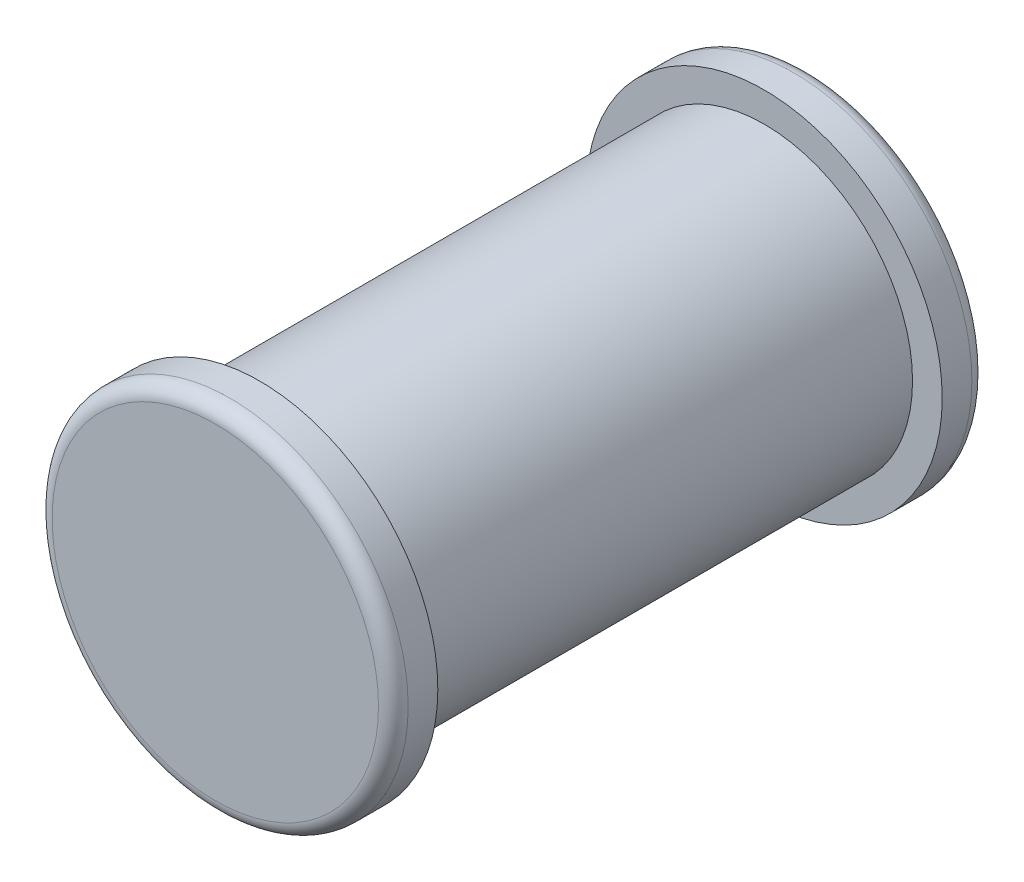
from build123d import *

# Parameters (mm, degrees)
SKETCH_1_R        = 10
EXTRUDE_1_DEPTH   = 40
EXTRUDE_START     = -3
SKETCH_3_R        = 12
SKETCH_3_R_2      = 10
EXTRUDE_1_2_DEPTH = 3
SKETCH_4_R        = 12
SKETCH_4_R_2      = 10
EXTRUDE_2_DEPTH   = 3
FILLET_4_R        = 1


with BuildPart() as part:
    # 草图1 → Extrude 1 (new body)
    with BuildSketch(Plane.XY):
        Circle(SKETCH_1_R)
    extrude(amount=EXTRUDE_1_DEPTH)

    # 草图3 → Extrude 1 2 (add)
    with BuildSketch(Plane.XY.offset(40).offset(EXTRUDE_START)):
        Circle(SKETCH_3_R)
        Circle(SKETCH_3_R_2, mode=Mode.SUBTRACT)
    extrude(amount=EXTRUDE_1_2_DEPTH)

    # 草图4 → 拉伸-薄壁2 (add)
    with BuildSketch(Plane(origin=(0, 0, 0), x_dir=(-1, 0, 0), z_dir=(0, 0, -1))):
        Circle(SKETCH_4_R)
        Circle(SKETCH_4_R_2, mode=Mode.SUBTRACT)
    extrude(amount=-EXTRUDE_2_DEPTH)

    # 圆角4
    fillet_4_edges = [part.edges().sort_by_distance(p)[0] for p in [
        (12, 0, 0),
        (-12, 0, 40),
    ]]
    fillet(fillet_4_edges, radius=FILLET_4_R)


solid = part.part
